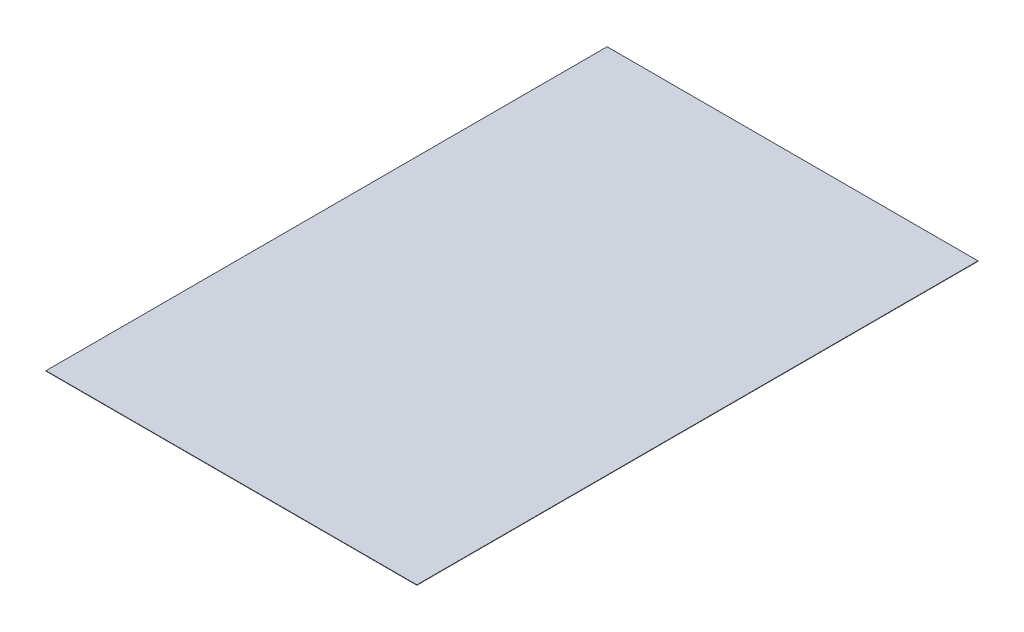
from build123d import *

# Parameters (mm, degrees)
SKETCH3_W               = 304.8
SKETCH3_H               = 0.2032
BOSS_EXTRUDE1_DEPTH     = 152.4
CUT_EXTRUDE1_DEPTH      = 216.526170853
CUT_EXTRUDE1_DEPTH_BACK = 216.526170853


with BuildPart() as part:
    # Sketch3 → Boss-Extrude1 (new, symmetric)
    with BuildSketch(Plane.XY):
        Rectangle(SKETCH3_W, SKETCH3_H)
    extrude(amount=BOSS_EXTRUDE1_DEPTH, both=True)

    # Sketch5 → Cut-Extrude1 (cut, two sides: drawn at the far end of the back side and taken through both)
    with BuildSketch(Plane(origin=(0, 0, 0), x_dir=(1, 0, 0), z_dir=(0, 1, 0)).offset(-CUT_EXTRUDE1_DEPTH_BACK)):
        Polygon((-152.4, 152.4), (-152.4, 147.32), (45.72, 147.32), (45.72, -152.4), (152.4, -152.4), (152.4, 152.4), align=None)
    extrude(amount=CUT_EXTRUDE1_DEPTH + CUT_EXTRUDE1_DEPTH_BACK, mode=Mode.SUBTRACT)


solid = part.part
